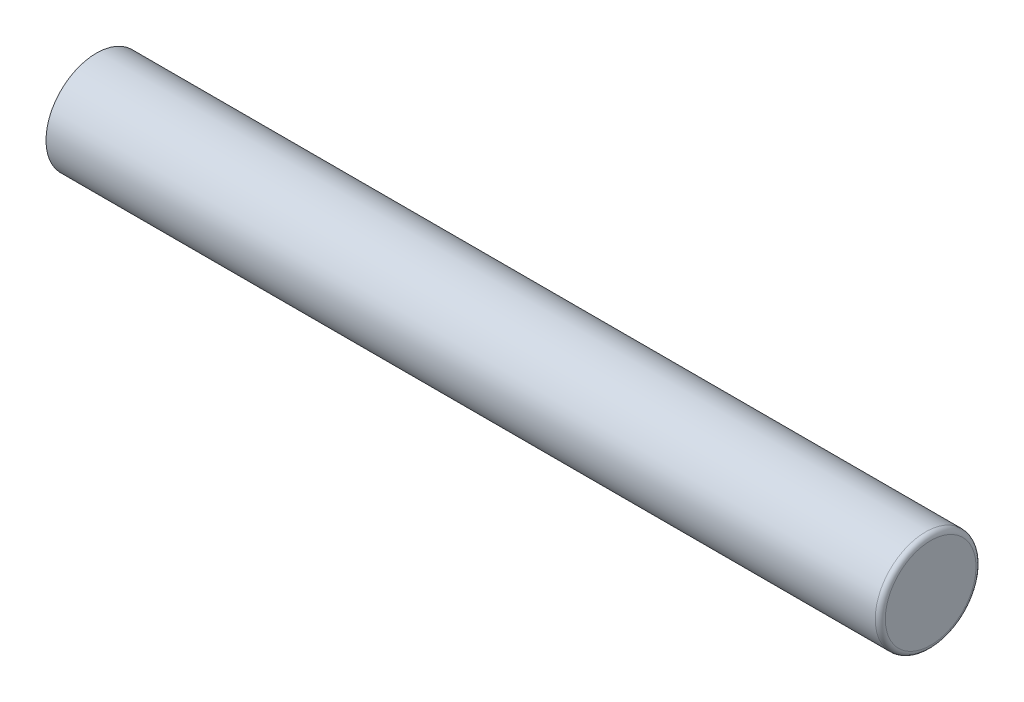
from build123d import *

# Parameters (mm, degrees)
CROQUIS1_W  = 41.4
CROQUIS1_H  = 2.5
REDONDEO1_R = 0.25


with BuildPart() as part:
    # Croquis1 → Revolución1 (revolve)
    with BuildSketch(Plane.XY, mode=Mode.PRIVATE) as revoluci_n1_sk:
        with Locations((20.7, 1.25)):
            Rectangle(CROQUIS1_W, CROQUIS1_H)
    revolve(revoluci_n1_sk.sketch.rotate(Axis((0, 0, 0), (1, 0, 0)), 90), axis=Axis((0, 0, 0), (1, 0, 0)))

    # Redondeo1
    redondeo1_edges = [part.edges().sort_by_distance(p)[0] for p in [
        (41.4, 0, -2.5),
    ]]
    fillet(redondeo1_edges, radius=REDONDEO1_R)


solid = part.part
